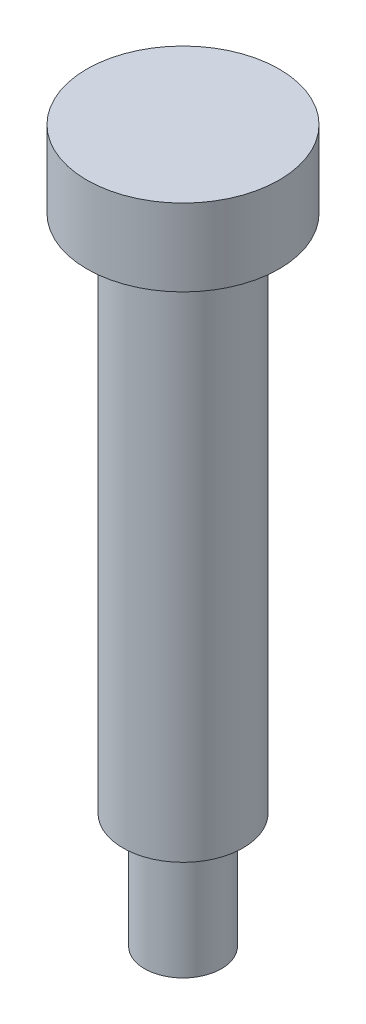
from build123d import *

# Parameters (mm, degrees)
SKETCH1_R           = 5
BOSS_EXTRUDE1_DEPTH = 4
SKETCH2_R           = 3.125
BOSS_EXTRUDE2_DEPTH = 27
SKETCH3_R           = 2
BOSS_EXTRUDE3_DEPTH = 6


with BuildPart() as part:
    # Sketch1 → Boss-Extrude1 (new body)
    with BuildSketch(Plane(origin=(0, 0, 0), x_dir=(1, 0, 0), z_dir=(0, 1, 0))):
        with Locations(Location((0, 0, 0), (0, 0, 270))):
            Circle(SKETCH1_R)
    extrude(amount=-BOSS_EXTRUDE1_DEPTH)

    # Sketch2 → Boss-Extrude2 (add)
    with BuildSketch(Plane.XZ.offset(4)):
        with Locations(Location((0, 0, 0), (0, 0, 270))):
            Circle(SKETCH2_R)
    extrude(amount=BOSS_EXTRUDE2_DEPTH)

    # Sketch3 → Boss-Extrude3 (add)
    with BuildSketch(Plane.XZ.offset(31)):
        with Locations(Location((0, 0, 0), (0, 0, 270))):
            Circle(SKETCH3_R)
    extrude(amount=BOSS_EXTRUDE3_DEPTH)


solid = part.part
